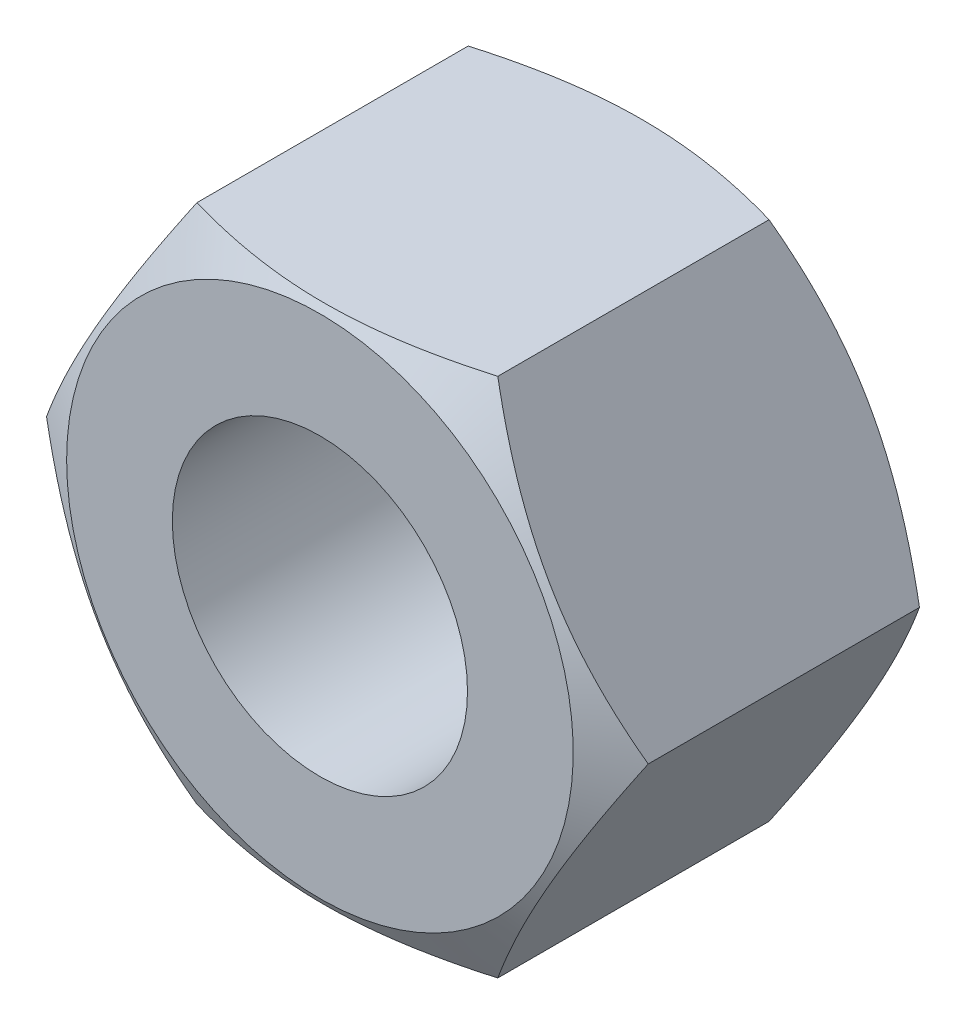
from build123d import *

# Parameters (mm, degrees)
SKETCH1_R     = 7.647
BASENUT_DEPTH = 16.9


with BuildPart() as part:
    # Sketch1 → BaseNut (new body)
    with BuildSketch(Plane.XY):
        Polygon((7.794228634, -13.5), (15.588457268, 0), (7.794228634, 13.5), (-7.794228634, 13.5), (-15.588457268, 0), (-7.794228634, -13.5), align=None)
        Circle(SKETCH1_R, mode=Mode.SUBTRACT)
    extrude(amount=-BASENUT_DEPTH)

    # Sketch2 → Double-Chamfer (revolve, cut)
    with BuildSketch(Plane(origin=(0, 0, 0), x_dir=(1, 0, 0), z_dir=(0, 1, 0))):
        Polygon((-15.588457268, 16.9), (-13.125, 16.9), (-15.588457268, 15.477722283), align=None)
        Polygon((-15.588457268, 1.422277717), (-15.588457268, 0), (-13.125, 0), align=None)
    revolve(axis=Axis((0, 0, -3.375940562), (0, 0, 1)), mode=Mode.SUBTRACT)


solid = part.part
